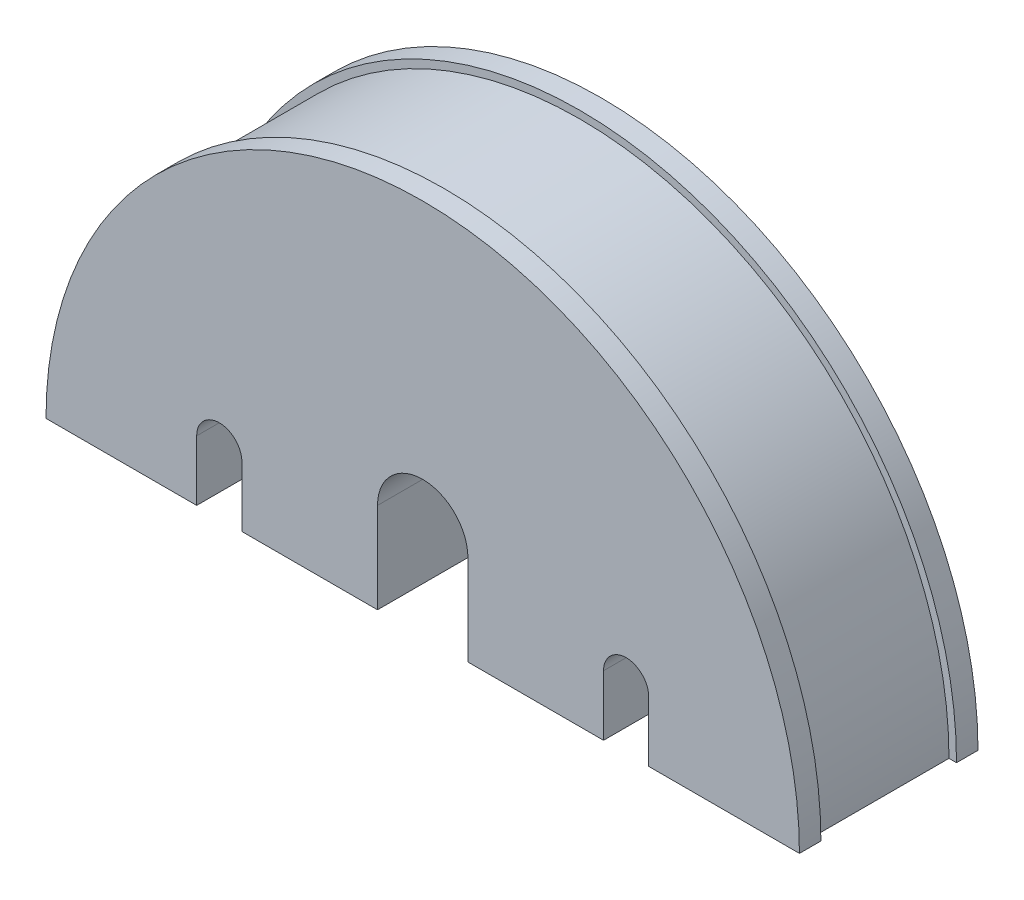
from build123d import *

# Parameters (mm, degrees)
EXTRUDE_1_DEPTH     = 118.5
SKETCH_2_W          = 20
SKETCH_2_H          = 180
CUT_REVOLVE_1_ANGLE = 180


with BuildPart() as part:
    # 草图1 → 凸台-拉伸1 (new, symmetric)
    with BuildSketch(Plane.XY):
        with BuildLine():
            Line((-500, 0), (-300, 0))
            Line((-300, 0), (-300, 80))
            ThreePointArc((-300, 80), (-270, 110), (-240, 80))
            Line((-240, 80), (-240, 0))
            Line((-240, 0), (-60, 0))
            Line((-60, 0), (-60, 120))
            ThreePointArc((-60, 120), (0, 180), (60, 120))
            Line((60, 120), (60, 0))
            Line((60, 0), (240, 0))
            Line((240, 0), (240, 80))
            ThreePointArc((240, 80), (270, 110), (300, 80))
            Line((300, 80), (300, 0))
            Line((300, 0), (500, 0))
            ThreePointArc((500, 0), (0, 500), (-500, 0))
        make_face()
    extrude(amount=EXTRUDE_1_DEPTH, both=True)

    # 草图2 → 切除-旋转1 (revolve, cut)
    with BuildSketch(Plane(origin=(0, 0, 0), x_dir=(1, 0, 0), z_dir=(0, 1, 0))):
        with Locations((500, 0)):
            Rectangle(SKETCH_2_W, SKETCH_2_H)
    revolve(axis=Axis((0, 0, -254.401615848), (0, 0, 1)), revolution_arc=CUT_REVOLVE_1_ANGLE, mode=Mode.SUBTRACT)


solid = part.part
